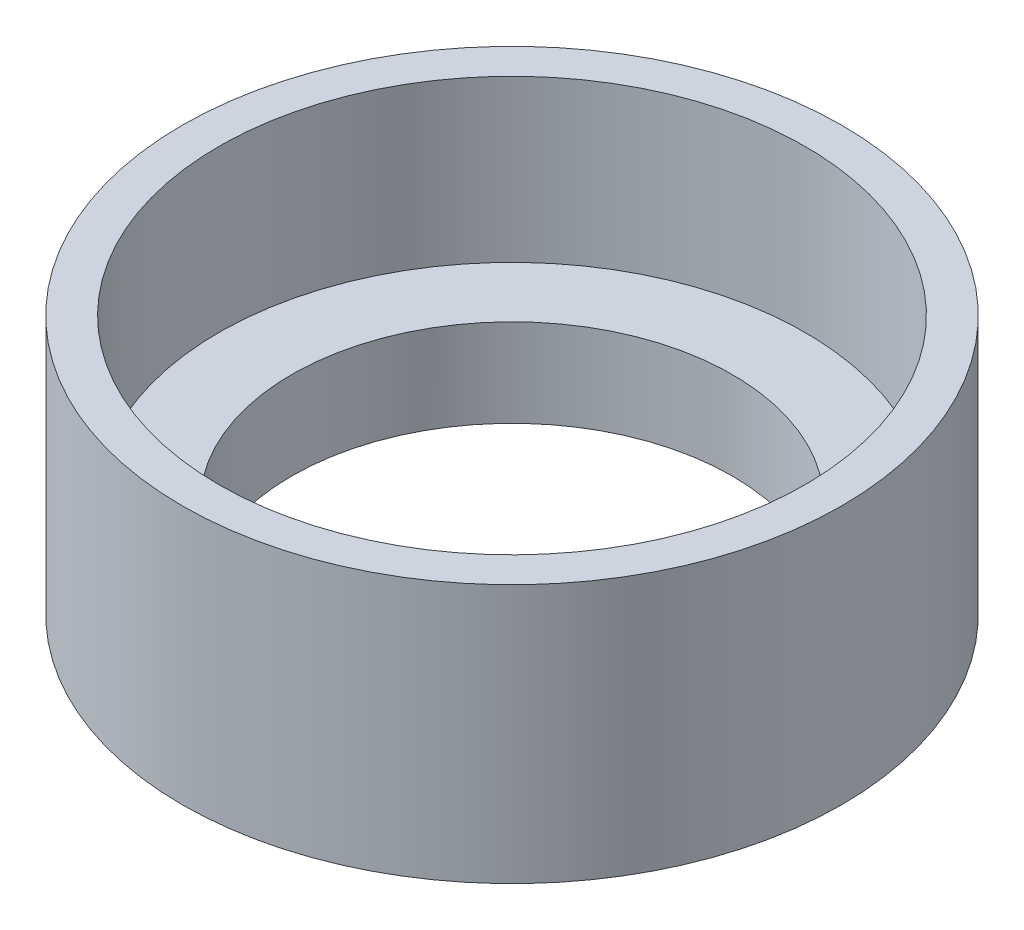
from build123d import *

# Parameters (mm, degrees)
SKETCH1_R            = 75
SKETCH1_R_2          = 62.3
BOSS_EXTRUDE1_DEPTH  = 53
BOSS_EXTRUDE3_START  = 3
SKETCH3_R            = 75
SKETCH3_R_2          = 47
BOSS_EXTRUDE3_DEPTH  = 3
BOSS_EXTRUDE4_START  = 14
SKETCH4_R            = 50.1
SKETCH4_R_2          = 47
BOSS_EXTRUDE4_DEPTH  = 14
BOSS_EXTRUDE5_START  = 1
SKETCH5_R            = 62.3
SKETCH5_R_2          = 50.1
BOSS_EXTRUDE5_DEPTH  = 1
CUT_EXTRUDE2_START   = -64
SKETCH6_R            = 75
SKETCH6_R_2          = 67.5
CUT_EXTRUDE2_DEPTH   = 64
BOSS_EXTRUDE6_REACH  = 111.186
SKETCH7_R            = 62.3
SKETCH7_R_2          = 60
SKETCH9_R            = 50.1
SKETCH9_R_2          = 47
CUT_EXTRUDE3_DEPTH   = 17
BOSS_EXTRUDE7_START  = -4
SKETCH10_R           = 50.1
SKETCH10_R_2         = 48.5
BOSS_EXTRUDE7_DEPTH  = 4
SKETCH12_R           = 48.5
SKETCH12_R_2         = 47.6
BOSS_EXTRUDE8_DEPTH  = 4
BOSS_EXTRUDE9_START  = -17
SKETCH13_R           = 47.6
SKETCH13_R_2         = 45.1
BOSS_EXTRUDE9_DEPTH  = 17
SKETCH14_R           = 47.65
SKETCH14_R_2         = 47.6
BOSS_EXTRUDE10_DEPTH = 13
BOSS_EXTRUDE11_START = 1
SKETCH15_R           = 47.65
SKETCH15_R_2         = 45.1
BOSS_EXTRUDE11_DEPTH = 1


with BuildPart() as part:
    # Sketch1 → Boss-Extrude1 (new body)
    with BuildSketch(Plane(origin=(0, 0, 0), x_dir=(1, 0, 0), z_dir=(0, 1, 0))):
        with Locations(Location((0, 0, 0), (0, 0, 270))):
            Circle(SKETCH1_R)
        with Locations(Location((0, 0, 0), (0, 0, 270))):
            Circle(SKETCH1_R_2, mode=Mode.SUBTRACT)
    extrude(amount=BOSS_EXTRUDE1_DEPTH)

    # Sketch3 → Boss-Extrude3 (add)
    with BuildSketch(Plane(origin=(0, 20, 0), x_dir=(-1, 0, 0), z_dir=(0, -1, 0)).offset(BOSS_EXTRUDE3_START)):
        with Locations(Location((0, 0, 0), (0, 0, 270))):
            Circle(SKETCH3_R)
        with Locations(Location((0, 0, 0), (0, 0, 90))):
            Circle(SKETCH3_R_2, mode=Mode.SUBTRACT)
    extrude(amount=-BOSS_EXTRUDE3_DEPTH)

    # Sketch4 → Boss-Extrude4 (add)
    with BuildSketch(Plane.XZ.offset(-17).offset(BOSS_EXTRUDE4_START)):
        with Locations(Location((0, 0, 0), (0, 0, 270))):
            Circle(SKETCH4_R)
        with Locations(Location((0, 0, 0), (0, 0, 270))):
            Circle(SKETCH4_R_2, mode=Mode.SUBTRACT)
    extrude(amount=-BOSS_EXTRUDE4_DEPTH)

    # Sketch5 → Boss-Extrude5 (add)
    with BuildSketch(Plane.XZ.offset(-17).offset(BOSS_EXTRUDE5_START)):
        with Locations(Location((0, 0, 0), (0, 0, 270))):
            Circle(SKETCH5_R)
        with Locations(Location((0, 0, 0), (0, 0, 270))):
            Circle(SKETCH5_R_2, mode=Mode.SUBTRACT)
    extrude(amount=-BOSS_EXTRUDE5_DEPTH)

    # Sketch6 → Cut-Extrude2 (cut)
    with BuildSketch(Plane(origin=(0, 53, 0), x_dir=(1, 0, 0), z_dir=(0, 1, 0)).offset(CUT_EXTRUDE2_START)):
        Circle(SKETCH6_R)
        with Locations(Location((0, 0, 0), (0, 0, 270))):
            Circle(SKETCH6_R_2, mode=Mode.SUBTRACT)
    extrude(amount=CUT_EXTRUDE2_DEPTH, mode=Mode.SUBTRACT)

    # Boss-Extrude6: up to this face of the body (flat: up to its plane)
    boss_extrude6_end = Plane(part.part.faces().sort_by_distance((0, 0, -65.590811691))[0])
    # Sketch7 → Boss-Extrude6 (add, up to the picked face)
    with BuildSketch(Plane(origin=(0, 53, 0), x_dir=(1, 0, 0), z_dir=(0, 1, 0)), mode=Mode.PRIVATE) as boss_extrude6_sk1:
        Circle(SKETCH7_R)
        with Locations(Location((0, 0, 0), (0, 0, 270))):
            Circle(SKETCH7_R_2, mode=Mode.SUBTRACT)
    boss_extrude6_tool1 = split(extrude(boss_extrude6_sk1.sketch, amount=-BOSS_EXTRUDE6_REACH, mode=Mode.PRIVATE), bisect_by=boss_extrude6_end, keep=Keep.BOTH, mode=Mode.PRIVATE)
    add(boss_extrude6_tool1.solids().sort_by(Axis((-60.53789, 53, 0), (0, -1, 0)))[0])

    # Sketch9 → Cut-Extrude3 (cut)
    with BuildSketch(Plane.XZ.offset(-3)):
        with Locations(Location((0, 0, 0), (0, 0, 270))):
            Circle(SKETCH9_R)
        Circle(SKETCH9_R_2, mode=Mode.SUBTRACT)
    extrude(amount=-CUT_EXTRUDE3_DEPTH, mode=Mode.SUBTRACT)

    # Sketch10 → Boss-Extrude7 (add)
    with BuildSketch(Plane(origin=(0, 20, 0), x_dir=(1, 0, 0), z_dir=(0, 1, 0)).offset(BOSS_EXTRUDE7_START)):
        Circle(SKETCH10_R)
        with Locations(Location((0, 0, 0), (0, 0, 270))):
            Circle(SKETCH10_R_2, mode=Mode.SUBTRACT)
    extrude(amount=BOSS_EXTRUDE7_DEPTH)

    # Sketch12 → Boss-Extrude8 (add)
    with BuildSketch(Plane.XZ.offset(-16)):
        Circle(SKETCH12_R)
        with Locations(Location((0, 0, 0), (0, 0, 270))):
            Circle(SKETCH12_R_2, mode=Mode.SUBTRACT)
    extrude(amount=-BOSS_EXTRUDE8_DEPTH)

    # Sketch13 → Boss-Extrude9 (add)
    with BuildSketch(Plane(origin=(0, 20, 0), x_dir=(1, 0, 0), z_dir=(0, 1, 0)).offset(BOSS_EXTRUDE9_START)):
        with Locations(Location((0, 0, 0), (0, 0, 270))):
            Circle(SKETCH13_R)
        with Locations(Location((0, 0, 0), (0, 0, 270))):
            Circle(SKETCH13_R_2, mode=Mode.SUBTRACT)
    extrude(amount=BOSS_EXTRUDE9_DEPTH)

    # Sketch14 → Boss-Extrude10 (add)
    with BuildSketch(Plane.XZ.offset(-3)):
        with Locations(Location((0, 0, 0), (0, 0, 270))):
            Circle(SKETCH14_R)
        Circle(SKETCH14_R_2, mode=Mode.SUBTRACT)
    extrude(amount=-BOSS_EXTRUDE10_DEPTH)

    # Sketch15 → Boss-Extrude11 (add)
    with BuildSketch(Plane.XZ.offset(-3).offset(BOSS_EXTRUDE11_START)):
        with Locations(Location((0, 0, 0), (0, 0, 270))):
            Circle(SKETCH15_R)
        with Locations(Location((0, 0, 0), (0, 0, 90))):
            Circle(SKETCH15_R_2, mode=Mode.SUBTRACT)
    extrude(amount=-BOSS_EXTRUDE11_DEPTH)


solid = part.part
